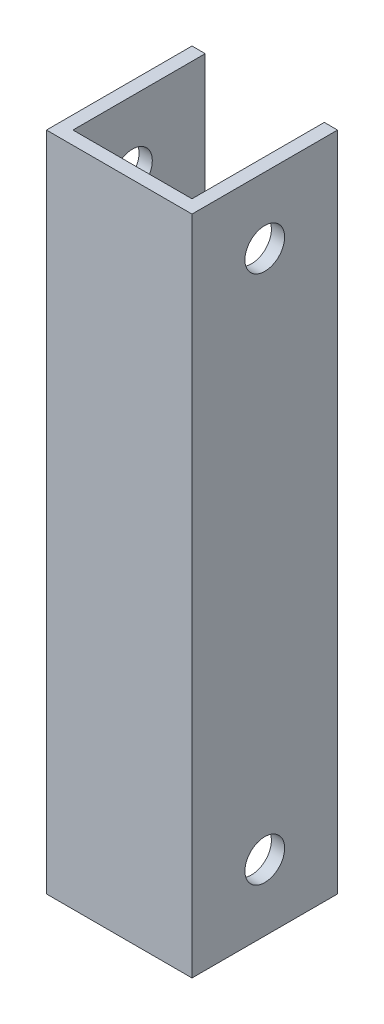
from build123d import *

# Parameters (mm, degrees)
SALIENTE_EXTRUIR1_DEPTH = 100
CROQUIS2_R              = 3
CORTAR_EXTRUIR1_DEPTH   = 100
CROQUIS3_R              = 3
CORTAR_EXTRUIR2_DEPTH   = 103.980580694


with BuildPart() as part:
    # Croquis1 → Saliente-Extruir1 (new body)
    with BuildSketch(Plane(origin=(0, 0, 0), x_dir=(1, 0, 0), z_dir=(0, 1, 0))):
        Polygon((-9, 11), (-9, -9), (9, -9), (9, 11), (11, 11), (11, -11), (-11, -11), (-11, 11), align=None)
    extrude(amount=SALIENTE_EXTRUIR1_DEPTH)

    # Croquis2 → Cortar-Extruir1 (cut)
    with BuildSketch(Plane(origin=(11, 0, 0), x_dir=(0, 0, -1), z_dir=(1, 0, 0))):
        with Locations((0, 10)):
            Circle(CROQUIS2_R)
    extrude(amount=-CORTAR_EXTRUIR1_DEPTH, mode=Mode.SUBTRACT)

    # Croquis3 → Cortar-Extruir2 (cut, through all)
    with BuildSketch(Plane(origin=(11, 0, 0), x_dir=(0, 0, -1), z_dir=(1, 0, 0))):
        with Locations((0, 90)):
            Circle(CROQUIS3_R)
    extrude(amount=-CORTAR_EXTRUIR2_DEPTH, mode=Mode.SUBTRACT)


solid = part.part
